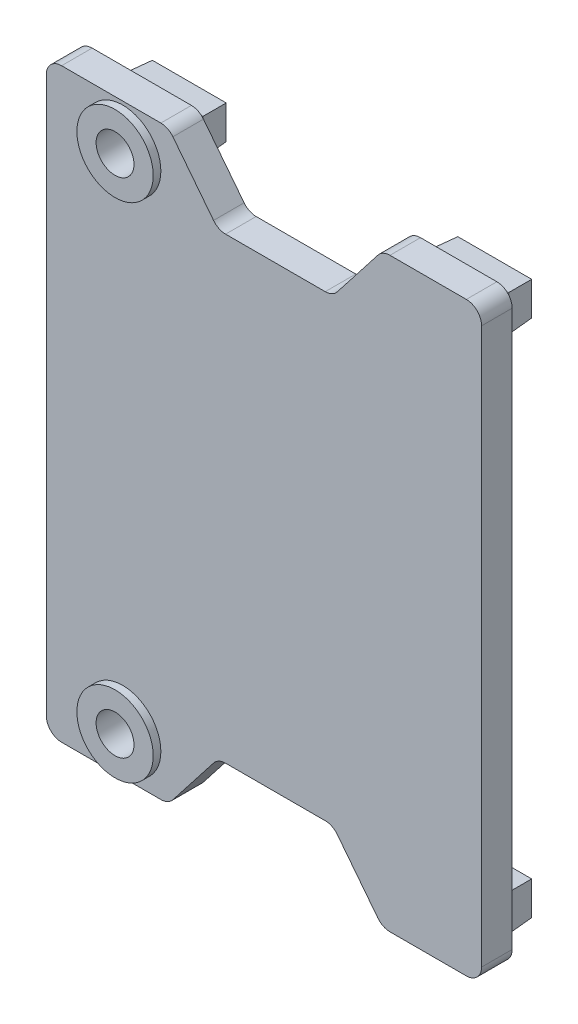
from build123d import *

# Parameters (mm, degrees)
SKETCH1_R                     = 1.575
BOSS_EXTRUDE1_DEPTH           = 2.54
SKETCH2_R                     = 3.175
SKETCH2_R_2                   = 1.575
BOSS_EXTRUDE2_DEPTH           = 0.635
SKETCH3_W                     = 6.35
SKETCH3_H                     = 3
BOSS_EXTRUDE3_DEPTH           = 1
SKETCH4_W                     = 6.35
SKETCH4_H                     = 3
BOSS_EXTRUDE4_DEPTH           = 2
BOSS_EXTRUDE4_DRAFT           = 3
BOSS_EXTRUDE4_PROFILE_2_DEPTH = 2
BOSS_EXTRUDE4_PROFILE_2_DRAFT = 3


with BuildPart() as part:
    # Sketch1 → Boss-Extrude1 (new body)
    with BuildSketch(Plane.XY):
        with BuildLine():
            Line((-184.15, 24.36), (-180.975, 24.36))
            ThreePointArc((-180.975, 24.36), (-180.417860718, 24.23126939), (-179.973667703, 23.871174521))
            Line((-179.973667703, 23.871174521), (-176.593849938, 19.538825479))
            ThreePointArc((-176.593849938, 19.538825479), (-176.149656923, 19.17873061), (-175.592517642, 19.05))
            Line((-175.592517642, 19.05), (-167.307482358, 19.05))
            ThreePointArc((-167.307482358, 19.05), (-166.750343077, 19.17873061), (-166.306150062, 19.538825479))
            Line((-166.306150062, 19.538825479), (-162.926332297, 23.871174521))
            ThreePointArc((-162.926332297, 23.871174521), (-162.482139282, 24.23126939), (-161.925, 24.36))
            Line((-161.925, 24.36), (-155.575, 24.36))
            ThreePointArc((-155.575, 24.36), (-154.676974388, 23.988025612), (-154.305, 23.09))
            Line((-154.305, 23.09), (-154.305, 0))
            Line((-154.305, 0), (-190.5, 0))
            Line((-190.5, 0), (-190.5, 23.09))
            ThreePointArc((-190.5, 23.09), (-190.128025612, 23.988025612), (-189.23, 24.36))
            Line((-189.23, 24.36), (-184.15, 24.36))
        make_face()
        with Locations((-184.15, 20.89645)):
            Circle(SKETCH1_R, mode=Mode.SUBTRACT)
    extrude(amount=BOSS_EXTRUDE1_DEPTH)

    # Sketch2 → Boss-Extrude2 (add)
    with BuildSketch(Plane.XY.offset(2.54)):
        with Locations((-184.15, 20.89645)):
            Circle(SKETCH2_R)
        with Locations((-184.15, 20.89645)):
            Circle(SKETCH2_R_2, mode=Mode.SUBTRACT)
    extrude(amount=BOSS_EXTRUDE2_DEPTH)

    # Sketch3 → Boss-Extrude3 (add)
    with BuildSketch(Plane(origin=(0, 0, 0), x_dir=(-1, 0, 0), z_dir=(0, 0, -1))):
        with Locations((184.15, 21.59)):
            Rectangle(SKETCH3_W, SKETCH3_H)
        with Locations((158.75, 21.59)):
            Rectangle(SKETCH3_W, SKETCH3_H)
    extrude(amount=BOSS_EXTRUDE3_DEPTH)


with BuildPart() as boss_extrude4_tool:
    # Sketch4 → Boss-Extrude4 (with draft: the straight prism first)
    with BuildSketch(Plane(origin=(0, 0, -1), x_dir=(-1, 0, 0), z_dir=(0, 0, -1))):
        with Locations((184.15, 21.59)):
            Rectangle(SKETCH4_W, SKETCH4_H)
    extrude(amount=BOSS_EXTRUDE4_DEPTH)
    # Boss-Extrude4: the draft: its side faces are tilted about the plane it starts from
    boss_extrude4_sides = [boss_extrude4_tool.faces().sort_by_distance(p)[0] for p in [
        (-180.975, 21.59, -2),
        (-184.15, 20.09, -2),
        (-187.325, 21.59, -2),
        (-184.15, 23.09, -2),
    ]]
    draft(boss_extrude4_sides, Plane(origin=(0, 0, -1), x_dir=(-1, 0, 0), z_dir=(0, 0, -1)), BOSS_EXTRUDE4_DRAFT)


with BuildPart() as part_1:
    add(part.part)

    # Boss-Extrude4: add boss_extrude4_tool
    add(boss_extrude4_tool.part)


with BuildPart() as boss_extrude4_profile_2_tool:
    # Sketch4 → Boss-Extrude4 profile 2 (with draft: the straight prism first)
    with BuildSketch(Plane(origin=(0, 0, -1), x_dir=(-1, 0, 0), z_dir=(0, 0, -1))):
        with Locations((158.75, 21.59)):
            Rectangle(SKETCH4_W, SKETCH4_H)
    extrude(amount=BOSS_EXTRUDE4_PROFILE_2_DEPTH)
    # Boss-Extrude4 profile 2: the draft: its side faces are tilted about the plane it starts from
    boss_extrude4_profile_2_sides = [boss_extrude4_profile_2_tool.faces().sort_by_distance(p)[0] for p in [
        (-155.575, 21.59, -2),
        (-158.75, 20.09, -2),
        (-161.925, 21.59, -2),
        (-158.75, 23.09, -2),
    ]]
    draft(boss_extrude4_profile_2_sides, Plane(origin=(0, 0, -1), x_dir=(-1, 0, 0), z_dir=(0, 0, -1)), BOSS_EXTRUDE4_PROFILE_2_DRAFT)


with BuildPart() as part_2:
    add(part_1.part)

    # Boss-Extrude4 profile 2: add boss_extrude4_profile_2_tool
    add(boss_extrude4_profile_2_tool.part)

    # Mirror1: part across plane


with BuildPart() as part_3:
    add(part_2.part)
    add(part_2.part.mirror(Plane.ZX))


solid = part_3.part
